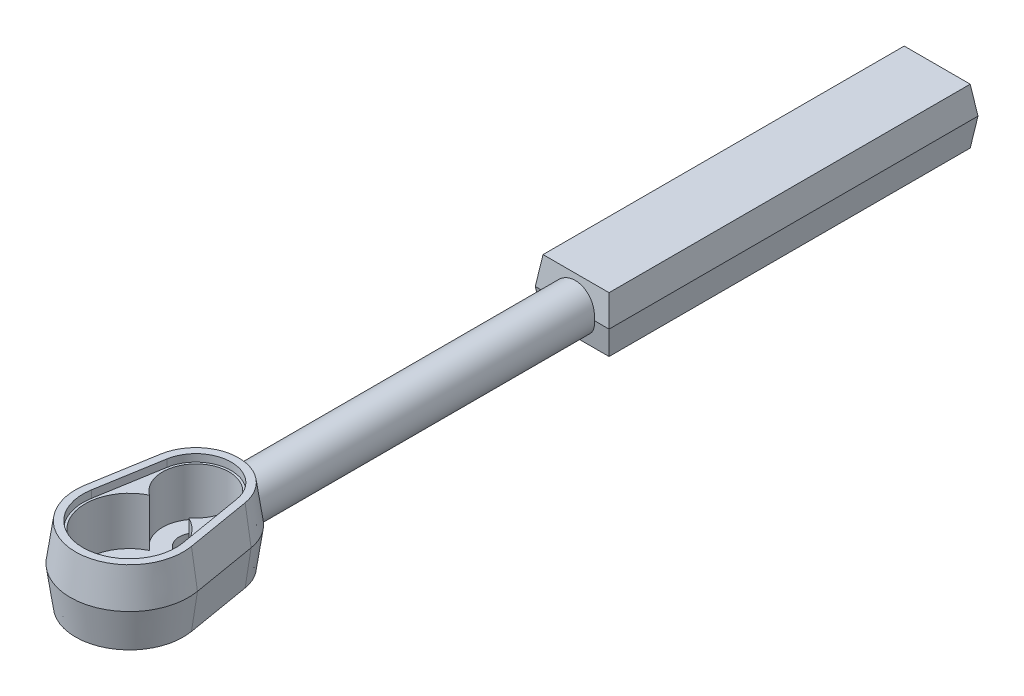
from build123d import *

# Parameters (mm, degrees)
CROQUIS1_W                        = 20
CROQUIS1_H                        = 100
MANGO_DEPTH                       = 7.5
MANGO_TAPER                       = 8
MANGO_OTHER_WAY_DEPTH             = 7.5
MANGO_OTHER_WAY_TAPER             = 8
TRANSICION_REACH                  = 222.355
CROQUIS2_R                        = 6
SALIENTE_EXTRUIR3_DEPTH           = 10
SALIENTE_EXTRUIR3_TAPER           = 8
SALIENTE_EXTRUIR3_OTHER_WAY_DEPTH = 10
SALIENTE_EXTRUIR3_OTHER_WAY_TAPER = 8
CORTAR_EXTRUIR1_DEPTH             = 2
CORTAR_EXTRUIR2_DEPTH             = 13
CROQUIS6_R                        = 4.5
CORTAR_EXTRUIR3_DEPTH             = 5
CROQUIS7_R                        = 6
CORTAR_EXTRUIR4_DEPTH             = 5


with BuildPart() as part:
    # Croquis1 → Mango (new body)
    with BuildSketch(Plane(origin=(0, 0, 0), x_dir=(1, 0, 0), z_dir=(0, 1, 0))):
        with Locations((0, 170)):
            Rectangle(CROQUIS1_W, CROQUIS1_H)
    extrude(amount=MANGO_DEPTH, taper=MANGO_TAPER)

    # Croquis1 → Mango other way (add)
    with BuildSketch(Plane(origin=(0, 0, 0), x_dir=(1, 0, 0), z_dir=(0, 1, 0))):
        with Locations((0, 170)):
            Rectangle(CROQUIS1_W, CROQUIS1_H)
    extrude(amount=-MANGO_OTHER_WAY_DEPTH, taper=MANGO_OTHER_WAY_TAPER)

    # Croquis2 → Transicion (add, up to next)
    with BuildSketch(Plane.XY, mode=Mode.PRIVATE) as transicion_sk1:
        Circle(CROQUIS2_R)
    transicion_tool1 = extrude(transicion_sk1.sketch, amount=-TRANSICION_REACH, mode=Mode.PRIVATE) - part.part
    add(transicion_tool1.solids().sort_by_distance((0, 0, 0))[0])

    # Croquis3 → Saliente-Extruir3 (add)
    with BuildSketch(Plane(origin=(0, 0, 0), x_dir=(1, 0, 0), z_dir=(0, 1, 0))):
        with BuildLine():
            ThreePointArc((12.818172863, 20.166666667), (0, 31), (-12.818172863, 20.166666667))
            Line((-12.818172863, 20.166666667), (-15.776212755, 2.666666667))
            ThreePointArc((-15.776212755, 2.666666667), (0, -16), (15.776212755, 2.666666667))
            Line((15.776212755, 2.666666667), (12.818172863, 20.166666667))
        make_face()
    extrude(amount=SALIENTE_EXTRUIR3_DEPTH, taper=SALIENTE_EXTRUIR3_TAPER)

    # Croquis3 → Saliente-Extruir3 other way (add)
    with BuildSketch(Plane(origin=(0, 0, 0), x_dir=(1, 0, 0), z_dir=(0, 1, 0))):
        with BuildLine():
            ThreePointArc((12.818172863, 20.166666667), (0, 31), (-12.818172863, 20.166666667))
            Line((-12.818172863, 20.166666667), (-15.776212755, 2.666666667))
            ThreePointArc((-15.776212755, 2.666666667), (0, -16), (15.776212755, 2.666666667))
            Line((15.776212755, 2.666666667), (12.818172863, 20.166666667))
        make_face()
    extrude(amount=-SALIENTE_EXTRUIR3_OTHER_WAY_DEPTH, taper=SALIENTE_EXTRUIR3_OTHER_WAY_TAPER)

    # Croquis4 → Cortar-Extruir1 (cut)
    with BuildSketch(Plane(origin=(0, 10, 0), x_dir=(1, 0, 0), z_dir=(0, 1, 0))):
        with BuildLine():
            Line((-9.460394951, 19.599098609), (-12.418434842, 2.099098609))
            ThreePointArc((-12.418434842, 2.099098609), (0, -12.594591653), (12.418434842, 2.099098609))
            Line((12.418434842, 2.099098609), (9.460394951, 19.599098609))
            ThreePointArc((9.460394951, 19.599098609), (0, 27.594591653), (-9.460394951, 19.599098609))
        make_face()
    extrude(amount=-CORTAR_EXTRUIR1_DEPTH, mode=Mode.SUBTRACT)

    # Croquis5 → Cortar-Extruir2 (cut)
    with BuildSketch(Plane(origin=(0, 8, 0), x_dir=(1, 0, 0), z_dir=(0, 1, 0))):
        with BuildLine():
            ThreePointArc((5.332682252, 10.75), (0, 27), (-5.332682252, 10.75))
            ThreePointArc((-5.332682252, 10.75), (0, -12), (5.332682252, 10.75))
        make_face()
    extrude(amount=-CORTAR_EXTRUIR2_DEPTH, mode=Mode.SUBTRACT)

    # Croquis6 → Cortar-Extruir3 (cut)
    with BuildSketch(Plane(origin=(0, -5, 0), x_dir=(1, 0, 0), z_dir=(0, 1, 0))):
        with Locations(Location((0, 18, 0), (0, 0, 270))):
            Circle(CROQUIS6_R)
    extrude(amount=-CORTAR_EXTRUIR3_DEPTH, mode=Mode.SUBTRACT)

    # Croquis7 → Cortar-Extruir4 (cut)
    with BuildSketch(Plane(origin=(0, -5, 0), x_dir=(1, 0, 0), z_dir=(0, 1, 0))):
        with Locations(Location((0, 0, 0), (0, 0, 270))):
            Circle(CROQUIS7_R)
    extrude(amount=-CORTAR_EXTRUIR4_DEPTH, mode=Mode.SUBTRACT)


solid = part.part
